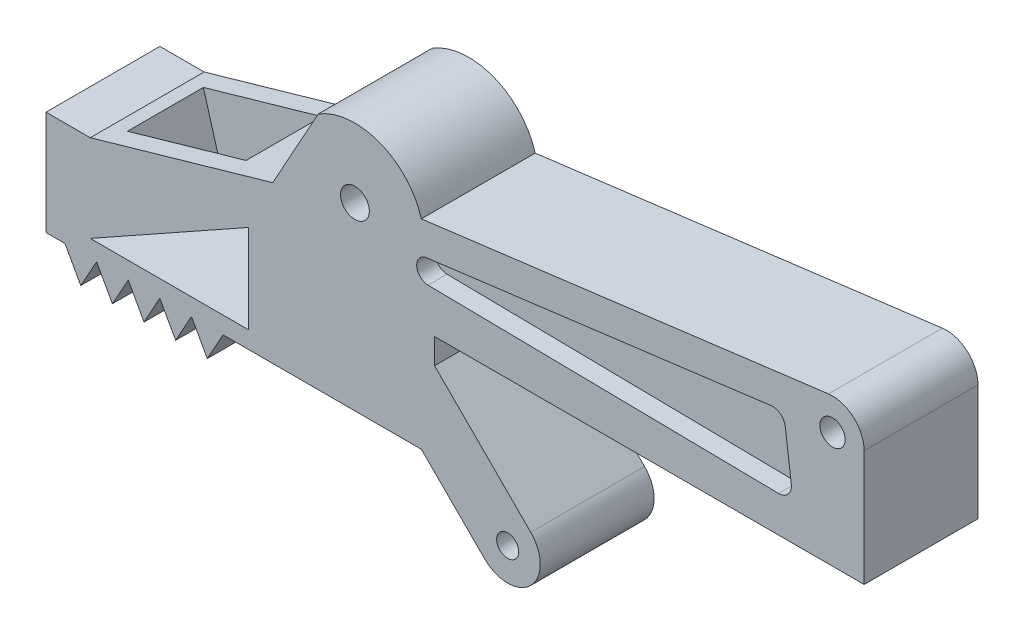
from build123d import *

# Parameters (mm, degrees)
SKETCH1_R            = 1.1375
SKETCH1_R_2          = 0.875
SKETCH1_R_3          = 1
BOSS_EXTRUDE1_DEPTH  = 9
CUT_EXTRUDE1_DEPTH   = 56.175080092
CUT_EXTRUDE2_REACH   = 58.746
SKETCH4_W            = 9.75
SKETCH4_H            = 6
CUT_EXTRUDE3_DEPTH   = 1.5
FILLET1_R            = 1
FILLET1_OF_MIRROR1_R = 1


with BuildPart() as part:
    # Sketch1 → Boss-Extrude1 (new body)
    with BuildSketch(Plane.XY):
        with BuildLine():
            Line((0, 0), (15.670430223, 0))
            Line((15.670430223, 0), (20.670430223, -5))
            ThreePointArc((20.670430223, -5), (24.313053668, -5), (24.313053668, -1.357376555))
            Line((24.313053668, -1.357376555), (16.71250591, 6.243171203))
            Line((16.71250591, 6.243171203), (16.71250591, 8.243171203))
            Line((16.71250591, 8.243171203), (50.666930898, 8.243171203))
            Line((50.666930898, 8.243171203), (50.666930898, 17.403556883))
            ThreePointArc((50.666930898, 17.403556883), (49.818924912, 19.279967227), (47.850198276, 19.883411807))
            Line((47.850198276, 19.883411807), (15.666930898, 15.772892856))
            ThreePointArc((15.666930898, 15.772892856), (12.366185788, 19.349870594), (7.521934274, 18.87773154))
            Line((7.521934274, 18.87773154), (3.918925439, 12.37773154))
            Line((3.918925439, 12.37773154), (-10.5, 8.243171203))
            Line((-10.5, 8.243171203), (-14, 8.243171203))
            Line((-14, 8.243171203), (-14, 0))
            Line((-14, 0), (-12.5, 0))
            Line((-12.5, 0), (-11.25, -2.25))
            Line((-11.25, -2.25), (-10, 0))
            Line((-10, 0), (-8.75, -2.25))
            Line((-8.75, -2.25), (-7.5, 0))
            Line((-7.5, 0), (-6.25, -2.25))
            Line((-6.25, -2.25), (-5, 0))
            Line((-5, 0), (-3.75, -2.25))
            Line((-3.75, -2.25), (-2.5, 0))
            Line((-2.5, 0), (-1.25, -2.25))
            Line((-1.25, -2.25), (0, 0))
        make_face()
        with Locations((10.418925439, 14.241576548)):
            Circle(SKETCH1_R, mode=Mode.SUBTRACT)
        with Locations((22.491741945, -3.178688277)):
            Circle(SKETCH1_R_2, mode=Mode.SUBTRACT)
        with Locations((48.166930898, 17.403556883)):
            Circle(SKETCH1_R_3, mode=Mode.SUBTRACT)
    extrude(amount=BOSS_EXTRUDE1_DEPTH)

    # Sketch3 → Cut-Extrude1 (cut, through all)
    with BuildSketch(Plane.XY.offset(9)):
        Polygon((-10.5, 1.35), (2, 1.35), (2, 8.35), align=None)
    extrude(amount=-CUT_EXTRUDE1_DEPTH, mode=Mode.SUBTRACT)

    # Cut-Extrude2: up to this plane
    cut_extrude2_end = Plane(origin=(2, 8.35, 0), z_dir=(-0.48860336893184564, 0.8725060159497188, 0))
    # Sketch4 → Cut-Extrude2 (cut, up to the surface)
    with BuildSketch(Plane(origin=(-2.981855105, 10.398964561, 0), x_dir=(0.9612616959383188, 0.2756373558169999, 0), z_dir=(-0.2756373558169999, 0.9612616959383188, 0)), mode=Mode.PRIVATE) as cut_extrude2_sk1:
        with Locations((-1.446121893, -4.5)):
            Rectangle(SKETCH4_W, SKETCH4_H)
    cut_extrude2_tool1 = split(extrude(cut_extrude2_sk1.sketch, amount=-CUT_EXTRUDE2_REACH, mode=Mode.PRIVATE), bisect_by=cut_extrude2_end, keep=Keep.BOTH, mode=Mode.PRIVATE)
    add(cut_extrude2_tool1.solids().sort_by_distance((-4.371957, 10.000359, 4.5))[0], mode=Mode.SUBTRACT)

    # Sketch5 → Cut-Extrude3 (cut)
    with BuildSketch(Plane.XY.offset(9)):
        with BuildLine():
            Line((16.200284742, 13.330448654), (44.30386483, 16.939697768))
            Line((44.30386483, 16.939697768), (45.056740957, 11.077394043))
            Line((45.056740957, 11.077394043), (16.200284742, 11.498637572))
            ThreePointArc((16.200284742, 11.498637572), (15.297651911, 12.414543113), (16.200284742, 13.330448654))
        make_face()
    cut_extrude3 = extrude(amount=-CUT_EXTRUDE3_DEPTH, mode=Mode.SUBTRACT)

    # Fillet1
    fillet1_edges = [part.edges().sort_by_distance(p)[0] for p in [
        (44.30386483, 16.939697768, 8.25),
        (45.056740957, 11.077394043, 8.25),
    ]]
    fillet(fillet1_edges, radius=FILLET1_R)

    # Mirror1: Cut-Extrude3 across plane
    add(cut_extrude3.mirror(Plane.XY.offset(4.5)), mode=Mode.SUBTRACT)

    # Fillet1 of Mirror1
    fillet1_of_mirror1_edges = [part.edges().sort_by_distance(p)[0] for p in [
        (44.30386483, 16.939697768, 0.75),
        (45.056740957, 11.077394043, 0.75),
    ]]
    fillet(fillet1_of_mirror1_edges, radius=FILLET1_OF_MIRROR1_R)


solid = part.part
